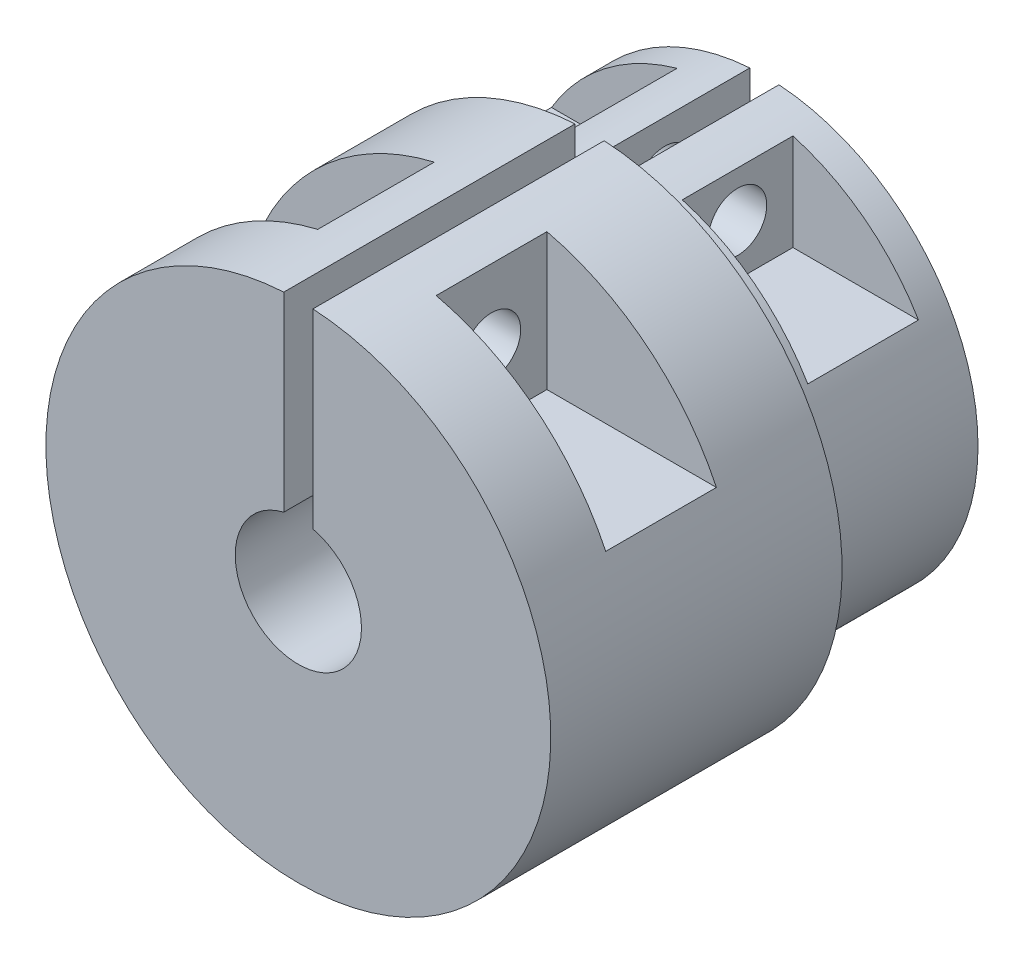
from build123d import *

# Parameters (mm, degrees)
SKETCH_1_R           = 13
EXTRUDE_1_DEPTH      = 9
SKETCH_2_R           = 13
SKETCH_2_R_2         = 3.25
EXTRUDE_2_DEPTH      = 15
SKETCH_3_W           = 1.5
SKETCH_3_H           = 11.626426752
CUT_EXTRUDE_3_DEPTH  = 31.232432916
SKETCH_7_R           = 16.638234873
SKETCH_7_R_2         = 11
CUT_EXTRUDE_9_DEPTH  = 9
CUTOFF_START         = -3
SKETCH_8_W           = 6
SKETCH_8_H           = 5.368740975
SKETCH_8_H_2         = 7.372686293
CUTOFF_DEPTH         = 20
SKETCH_10_R          = 1.5
CUT_EXTRUDE_12_DEPTH = 32.638584039
CUT_EXTRUDE_START    = 3
SKETCH_9_W           = 5.7
SKETCH_9_H           = 7.372686293
SKETCH_9_H_2         = 5.368740975
CUT_EXTRUDE_11_DEPTH = 20


with BuildPart() as part:
    # Эскиз1 → Вытянуть1 (new body)
    with BuildSketch(Plane.XY):
        Circle(SKETCH_1_R)
        with BuildLine():
            Line((-4.5, 3.659234893), (-4.5, -3.659234893))
            ThreePointArc((-4.5, -3.659234893), (0, -5.8), (4.5, -3.659234893))
            Line((4.5, -3.659234893), (4.5, 3.659234893))
            ThreePointArc((4.5, 3.659234893), (0, 5.8), (-4.5, 3.659234893))
        make_face(mode=Mode.SUBTRACT)
    extrude(amount=EXTRUDE_1_DEPTH)

    # Эскиз2 → Вытянуть2 (add)
    with BuildSketch(Plane.XY.offset(9)):
        Circle(SKETCH_2_R)
        Circle(SKETCH_2_R_2, mode=Mode.SUBTRACT)
    extrude(amount=EXTRUDE_2_DEPTH)

    # Эскиз3 → Вытянуть3 (cut, through all)
    with BuildSketch(Plane(origin=(0, 0, 0), x_dir=(-1, 0, 0), z_dir=(0, 0, -1))):
        with Locations((0, 7.379803008)):
            Rectangle(SKETCH_3_W, SKETCH_3_H)
    extrude(amount=-CUT_EXTRUDE_3_DEPTH, mode=Mode.SUBTRACT)

    # Эскиз7 → Вытянуть9 (cut)
    with BuildSketch(Plane(origin=(0, 0, 0), x_dir=(-1, 0, 0), z_dir=(0, 0, -1))):
        Circle(SKETCH_7_R)
        Circle(SKETCH_7_R_2, mode=Mode.SUBTRACT)
    extrude(amount=-CUT_EXTRUDE_9_DEPTH, mode=Mode.SUBTRACT)

    # Эскиз8 → cutoff (cut)
    with BuildSketch(Plane(origin=(0, 0, 0), x_dir=(0, 0, -1), z_dir=(1, 0, 0)).offset(CUTOFF_START)):
        with Locations((-4.5, 8.290031546)):
            Rectangle(SKETCH_8_W, SKETCH_8_H)
        with Locations((-17, 9.292004205)):
            Rectangle(SKETCH_8_W, SKETCH_8_H_2)
    extrude(amount=-CUTOFF_DEPTH, mode=Mode.SUBTRACT)

    # Эскиз10 → Вытянуть12 (cut, through all)
    with BuildSketch(Plane.ZY.offset(3)):
        with Locations(Location((4.38073417, 8.174442111, 0), (0, 0, 90))):
            Circle(SKETCH_10_R)
        with Locations(Location((17.050484779, 8.958138025, 0), (0, 0, 90))):
            Circle(SKETCH_10_R)
    extrude(amount=-CUT_EXTRUDE_12_DEPTH, mode=Mode.SUBTRACT)

    # Эскиз9 → Вытянуть11 (cut)
    with BuildSketch(Plane(origin=(0, 0, 0), x_dir=(0, 0, -1), z_dir=(1, 0, 0)).offset(CUT_EXTRUDE_START)):
        with Locations((-17.050484779, 9.292004205)):
            Rectangle(SKETCH_9_W, SKETCH_9_H)
        with Locations((-4.38073417, 8.290031546)):
            Rectangle(SKETCH_9_W, SKETCH_9_H_2)
    extrude(amount=CUT_EXTRUDE_11_DEPTH, mode=Mode.SUBTRACT)


solid = part.part
